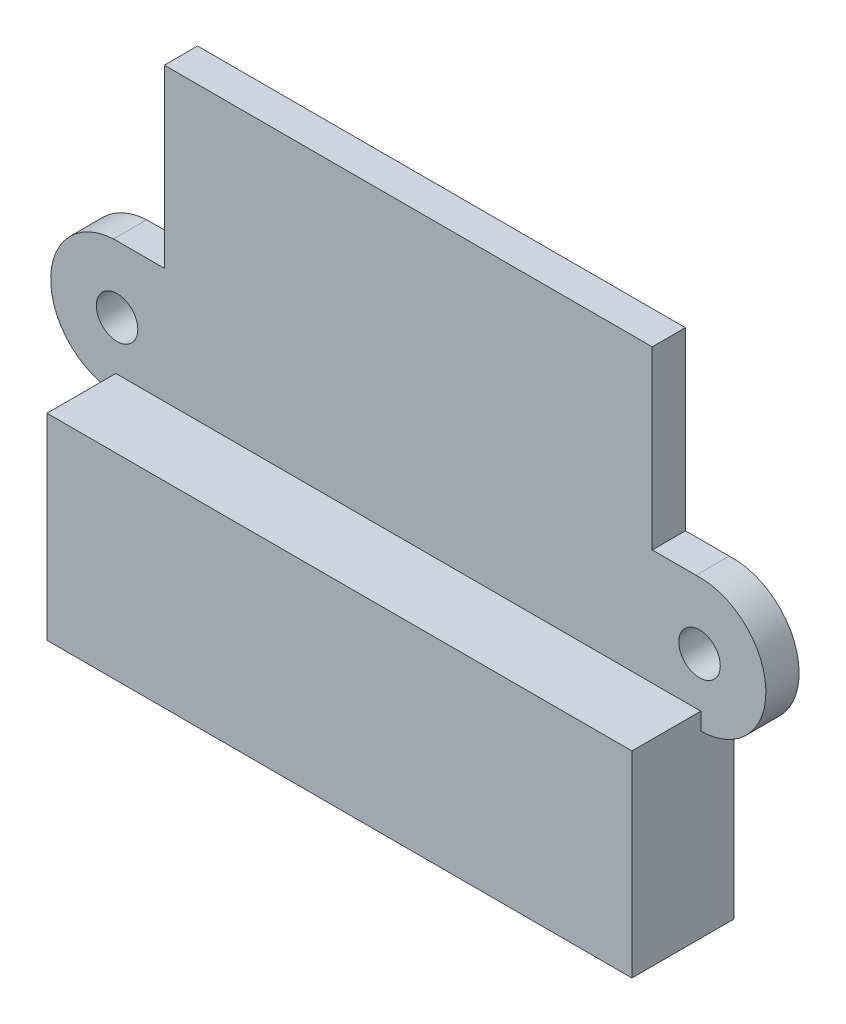
from build123d import *

# Parameters (mm, degrees)
SKETCH1_R           = 0.635000006
BOSS_EXTRUDE1_DEPTH = 1.016
SKETCH2_W           = 17.907
SKETCH2_H           = 6.0198
BOSS_EXTRUDE2_DEPTH = 2.1082


with BuildPart() as part:
    # Sketch1 → Boss-Extrude1 (new body)
    with BuildSketch(Plane.XY):
        with BuildLine():
            Line((-7.4676, 7.4676), (7.4676, 7.4676))
            Line((7.4676, 7.4676), (7.4676, 2.0828))
            Line((7.4676, 2.0828), (8.808625011, 2.0828))
            ThreePointArc((8.808625011, 2.0828), (10.946108081, 0.126055131), (8.9535, -1.978035503))
            Line((8.9535, -1.978035503), (8.9535, -7.4676))
            Line((8.9535, -7.4676), (-8.9535, -7.4676))
            Line((-8.9535, -7.4676), (-8.9535, -1.978035503))
            ThreePointArc((-8.9535, -1.978035503), (-10.947109486, 0.019247939), (-9.022174989, 2.0828))
            Line((-9.022174989, 2.0828), (-7.4676, 2.0828))
            Line((-7.4676, 2.0828), (-7.4676, 7.4676))
        make_face()
        with Locations((-8.9154, 0.053607278)):
            Circle(SKETCH1_R, mode=Mode.SUBTRACT)
        with Locations((8.9154, 0.053607278)):
            Circle(SKETCH1_R, mode=Mode.SUBTRACT)
    extrude(amount=BOSS_EXTRUDE1_DEPTH)

    # Sketch2 → Boss-Extrude2 (add)
    with BuildSketch(Plane.XY.offset(1.016)):
        with Locations((0, -4.4577)):
            Rectangle(SKETCH2_W, SKETCH2_H)
    extrude(amount=BOSS_EXTRUDE2_DEPTH)


solid = part.part
